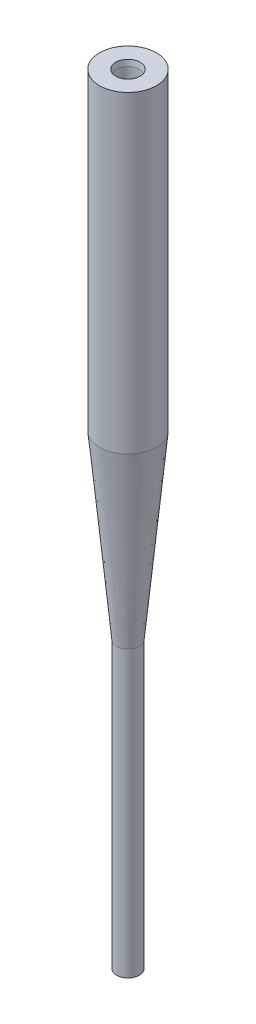
from build123d import *

# Parameters (mm, degrees)
SKETCH3_R          = 2.8067
CUT_EXTRUDE1_DEPTH = 12
CHAMFER1_SIZE      = 0.4
CHAMFER1_SIZE2     = 1.098990968
SKETCH4_R          = 2
CUT_EXTRUDE2_DEPTH = 6
CHAMFER2_SIZE      = 1
CHAMFER2_SIZE2     = 0.140540835


with BuildPart() as part:
    # Sketch1 → Revolve1 (revolve)
    with BuildSketch(Plane.XY, mode=Mode.PRIVATE) as revolve1_sk:
        Polygon((0, 95.25), (15.875, 95.25), (15.875, 0), (6.352863958, 0), (6.352863958, -38.836595706), (7.9248, -44.181178248), (7.9248, -52.07), (0, -52.07), align=None)
    revolve(revolve1_sk.sketch.rotate(Axis((0, 95.25, 0), (0, -1, 0)), 180), axis=Axis((0, 95.25, 0), (0, -1, 0)))

    # Sketch3 → Cut-Extrude1 (cut)
    with BuildSketch(Plane.XZ.offset(52.07)):
        Circle(SKETCH3_R)
    extrude(amount=-CUT_EXTRUDE1_DEPTH, mode=Mode.SUBTRACT)

    # Chamfer1
    chamfer1_edges = [part.edges().sort_by_distance(p)[0] for p in [
        (-2.8067, -52.07, 0),
    ]]
    chamfer1_side = [part.faces().sort_by_distance(p)[0] for p in [
        (7.700652807, -52.07, 0),
    ]]
    chamfer(chamfer1_edges, length=CHAMFER1_SIZE, length2=CHAMFER1_SIZE2, reference=chamfer1_side[0])


with BuildPart() as body_2:
    # Sketch2 → Revolve2 (revolve)
    with BuildSketch(Plane.XY, mode=Mode.PRIVATE) as revolve2_sk:
        Polygon((0, -52.07), (0, -188.87), (2, -188.87), (2, -138.87), (5, -107.07), (5, -52.07), align=None)
    revolve(revolve2_sk.sketch.rotate(Axis((0, -52.07, 0), (0, -1, 0)), 180), axis=Axis((0, -52.07, 0), (0, -1, 0)))

    # Sketch4 → Cut-Extrude2 (cut)
    with BuildSketch(Plane(origin=(0, -52.07, 0), x_dir=(1, 0, 0), z_dir=(0, 1, 0))):
        with Locations(Location((0, 0, 0), (0, 0, 180))):
            Circle(SKETCH4_R)
    extrude(amount=-CUT_EXTRUDE2_DEPTH, mode=Mode.SUBTRACT)

    # Chamfer2
    chamfer2_edges = [body_2.edges().sort_by_distance(p)[0] for p in [
        (2, -52.07, 0),
    ]]
    chamfer2_side = [body_2.faces().sort_by_distance(p)[0] for p in [
        (2, -55.07, 0),
    ]]
    chamfer(chamfer2_edges, length=CHAMFER2_SIZE, length2=CHAMFER2_SIZE2, reference=chamfer2_side[0])


solid = body_2.part
